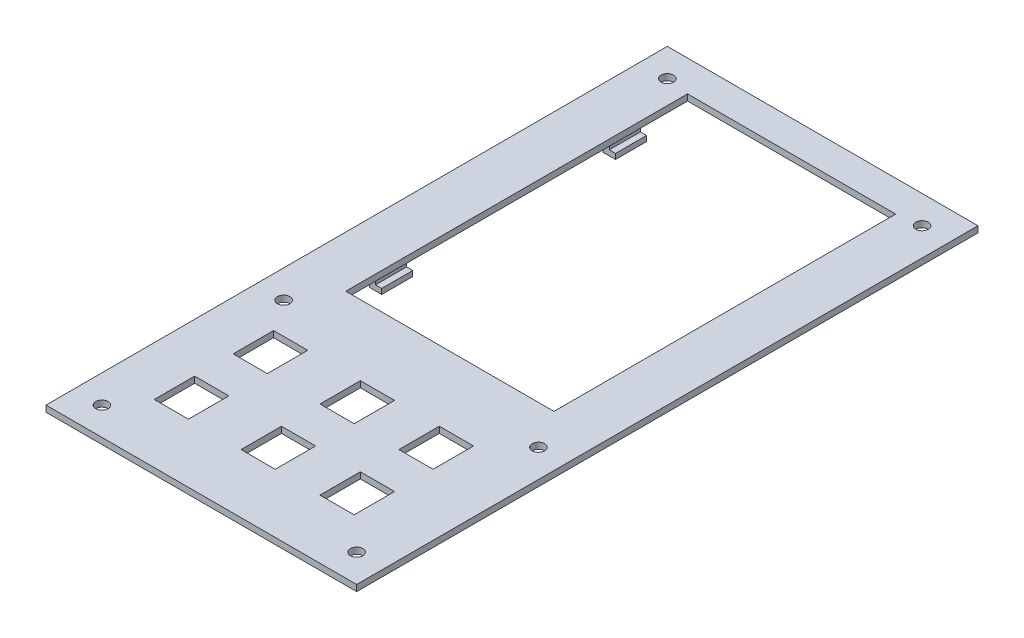
from build123d import *

# Parameters (mm, degrees)
SKETCH1_W           = 100
SKETCH1_H           = 200
SKETCH1_W_2         = 67
SKETCH1_H_2         = 110
BOSS_EXTRUDE1_DEPTH = 2
SKETCH2_W           = 100
SKETCH2_H           = 200
SKETCH2_W_2         = 94
SKETCH2_H_2         = 194
BOSS_EXTRUDE2_DEPTH = 16.4
SKETCH3_R           = 1.15
BOSS_EXTRUDE3_DEPTH = 2
BOSS_EXTRUDE4_DEPTH = 25
SKETCH8_W           = 100
SKETCH8_H           = 110
BOSS_EXTRUDE5_DEPTH = 3
SKETCH9_W           = 11
SKETCH9_H           = 13
CUT_EXTRUDE2_DEPTH  = 36
SKETCH10_W          = 7
SKETCH10_H          = 3
CUT_EXTRUDE3_DEPTH  = 10
SKETCH11_W          = 3
SKETCH11_H          = 7
CUT_EXTRUDE4_DEPTH  = 10
SKETCH12_W          = 100
SKETCH12_H          = 17.4
CUT_EXTRUDE5_DEPTH  = 3
SKETCH13_W          = 146.237469439
SKETCH13_H          = 217.9364229
CUT_EXTRUDE6_DEPTH  = 57
SKETCH14_R          = 2
CUT_EXTRUDE7_DEPTH  = 57
SKETCH15_W          = 2
SKETCH15_H          = 10
SKETCH15_W_2        = 10
SKETCH15_H_2        = 2
BOSS_EXTRUDE6_DEPTH = 5
SKETCH16_W          = 10
SKETCH16_H          = 1.7
BOSS_EXTRUDE7_DEPTH = 2
SKETCH17_W          = 10
SKETCH17_H          = 1.7
BOSS_EXTRUDE8_DEPTH = 2


with BuildPart() as part:
    # Sketch1 → Boss-Extrude1 (new body)
    with BuildSketch(Plane(origin=(0, 0, 0), x_dir=(1, 0, 0), z_dir=(0, 1, 0))):
        Rectangle(SKETCH1_W, SKETCH1_H)
        with Locations((0, 35)):
            Rectangle(SKETCH1_W_2, SKETCH1_H_2, mode=Mode.SUBTRACT)
    extrude(amount=BOSS_EXTRUDE1_DEPTH)

    # Sketch2 → Boss-Extrude2 (add)
    with BuildSketch(Plane.XZ):
        Rectangle(SKETCH2_W, SKETCH2_H)
        Rectangle(SKETCH2_W_2, SKETCH2_H_2, mode=Mode.SUBTRACT)
    extrude(amount=BOSS_EXTRUDE2_DEPTH)

    # Sketch3 → Boss-Extrude3 (add)
    with BuildSketch(Plane.XZ.offset(16.4)):
        Polygon((-50, 100), (50, 100), (50, 10), (50, -9), (30, -9), (30, 1), (35, 1), (35, 10), (35, 80), (-35, 80), (-35, 10), (-35, 1), (-30, 1), (-30, -9), (-50, -9), (-50, 10), align=None)
        with Locations(Location((-35, 85, 0), (0, 0, 270))):
            Circle(SKETCH3_R, mode=Mode.SUBTRACT)
        with Locations(Location((35, 85, 0), (0, 0, 270))):
            Circle(SKETCH3_R, mode=Mode.SUBTRACT)
        with Locations(Location((-35, -4, 0), (0, 0, 270))):
            Circle(SKETCH3_R, mode=Mode.SUBTRACT)
        with Locations(Location((35, -4, 0), (0, 0, 270))):
            Circle(SKETCH3_R, mode=Mode.SUBTRACT)
    extrude(amount=BOSS_EXTRUDE3_DEPTH)

    # Sketch5 → Boss-Extrude4 (add)
    with BuildSketch(Plane.XZ.offset(16.4)):
        Polygon((-50, -100), (50, -100), (50, -97), (50, 10), (47, 10), (47, -97), (-47, -97), (-47, 10), (-50, 10), (-50, -97), align=None)
    extrude(amount=BOSS_EXTRUDE4_DEPTH)

    # Sketch8 → Boss-Extrude5 (add)
    with BuildSketch(Plane.XZ.offset(41.4)):
        with Locations((0, -45)):
            Rectangle(SKETCH8_W, SKETCH8_H)
    extrude(amount=BOSS_EXTRUDE5_DEPTH)

    # Sketch9 → Cut-Extrude2 (cut)
    with BuildSketch(Plane(origin=(0, -16.4, 0), x_dir=(1, 0, 0), z_dir=(0, 1, 0))):
        with Locations((-28.65, -74.5)):
            Rectangle(SKETCH9_W, SKETCH9_H)
        with Locations((-0.71, -74.5)):
            Rectangle(SKETCH9_W, SKETCH9_H)
        with Locations((24.69, -74.5)):
            Rectangle(SKETCH9_W, SKETCH9_H)
        with Locations((-28.65, -49.1)):
            Rectangle(SKETCH9_W, SKETCH9_H)
        with Locations((-0.71, -49.1)):
            Rectangle(SKETCH9_W, SKETCH9_H)
        with Locations((24.69, -49.1)):
            Rectangle(SKETCH9_W, SKETCH9_H)
    extrude(amount=CUT_EXTRUDE2_DEPTH, mode=Mode.SUBTRACT)

    # Sketch10 → Cut-Extrude3 (cut)
    with BuildSketch(Plane.XZ.offset(44.4)):
        with Locations((-39.5, 5)):
            Rectangle(SKETCH10_W, SKETCH10_H)
        with Locations((39.5, 5)):
            Rectangle(SKETCH10_W, SKETCH10_H)
    extrude(amount=-CUT_EXTRUDE3_DEPTH, mode=Mode.SUBTRACT)

    # Sketch11 → Cut-Extrude4 (cut)
    with BuildSketch(Plane.XZ.offset(18.4)):
        with Locations((-45, 91.5)):
            Rectangle(SKETCH11_W, SKETCH11_H)
        with Locations((45, 91.5)):
            Rectangle(SKETCH11_W, SKETCH11_H)
    extrude(amount=-CUT_EXTRUDE4_DEPTH, mode=Mode.SUBTRACT)

    # Sketch12 → Cut-Extrude5 (cut)
    with BuildSketch(Plane.XY.offset(100)):
        with Locations((0, -9.7)):
            Rectangle(SKETCH12_W, SKETCH12_H)
    extrude(amount=-CUT_EXTRUDE5_DEPTH, mode=Mode.SUBTRACT)

    # Sketch13 → Cut-Extrude6 (cut)
    with BuildSketch(Plane.XZ):
        with Locations((11.358250054, -1.301466152)):
            Rectangle(SKETCH13_W, SKETCH13_H)
    extrude(amount=CUT_EXTRUDE6_DEPTH, mode=Mode.SUBTRACT)

    # Sketch14 → Cut-Extrude7 (cut)
    with BuildSketch(Plane(origin=(0, 2, 0), x_dir=(1, 0, 0), z_dir=(0, 1, 0))):
        with Locations(Location((-41, -91, 0), (0, 0, 270))):
            Circle(SKETCH14_R)
        with Locations(Location((41, -91, 0), (0, 0, 270))):
            Circle(SKETCH14_R)
        with Locations(Location((41, -32.5, 0), (0, 0, 270))):
            Circle(SKETCH14_R)
        with Locations(Location((-41, -32.5, 0), (0, 0, 270))):
            Circle(SKETCH14_R)
        with Locations(Location((-41, 91, 0), (0, 0, 270))):
            Circle(SKETCH14_R)
        with Locations(Location((41, 91, 0), (0, 0, 270))):
            Circle(SKETCH14_R)
    extrude(amount=-CUT_EXTRUDE7_DEPTH, mode=Mode.SUBTRACT)

    # Sketch15 → Boss-Extrude6 (add)
    with BuildSketch(Plane.XZ):
        with Locations((-36.8, 3.147463841)):
            Rectangle(SKETCH15_W, SKETCH15_H)
        with Locations((-36.8, -72.12250392)):
            Rectangle(SKETCH15_W, SKETCH15_H)
        with Locations((40.8, 5)):
            Rectangle(SKETCH15_W, SKETCH15_H)
        with Locations((40.8, -72.12250392)):
            Rectangle(SKETCH15_W, SKETCH15_H)
        with Locations((-1.11415266, -96)):
            Rectangle(SKETCH15_W_2, SKETCH15_H_2)
        with Locations((-1.11415266, 27)):
            Rectangle(SKETCH15_W_2, SKETCH15_H_2)
    extrude(amount=BOSS_EXTRUDE6_DEPTH)

    # Sketch16 → Boss-Extrude7 (add)
    with BuildSketch(Plane(origin=(-35.8, 0, 0), x_dir=(0, 0, -1), z_dir=(1, 0, 0))):
        with Locations((-3.147463841, -4.15)):
            Rectangle(SKETCH16_W, SKETCH16_H)
        with Locations((72.12250392, -4.15)):
            Rectangle(SKETCH16_W, SKETCH16_H)
    extrude(amount=BOSS_EXTRUDE7_DEPTH)

    # Sketch17 → Boss-Extrude8 (add)
    with BuildSketch(Plane.ZY.offset(-39.8)):
        with Locations((5, -4.15)):
            Rectangle(SKETCH17_W, SKETCH17_H)
        with Locations((-72.12250392, -4.15)):
            Rectangle(SKETCH17_W, SKETCH17_H)
    extrude(amount=BOSS_EXTRUDE8_DEPTH)


solid = part.part
